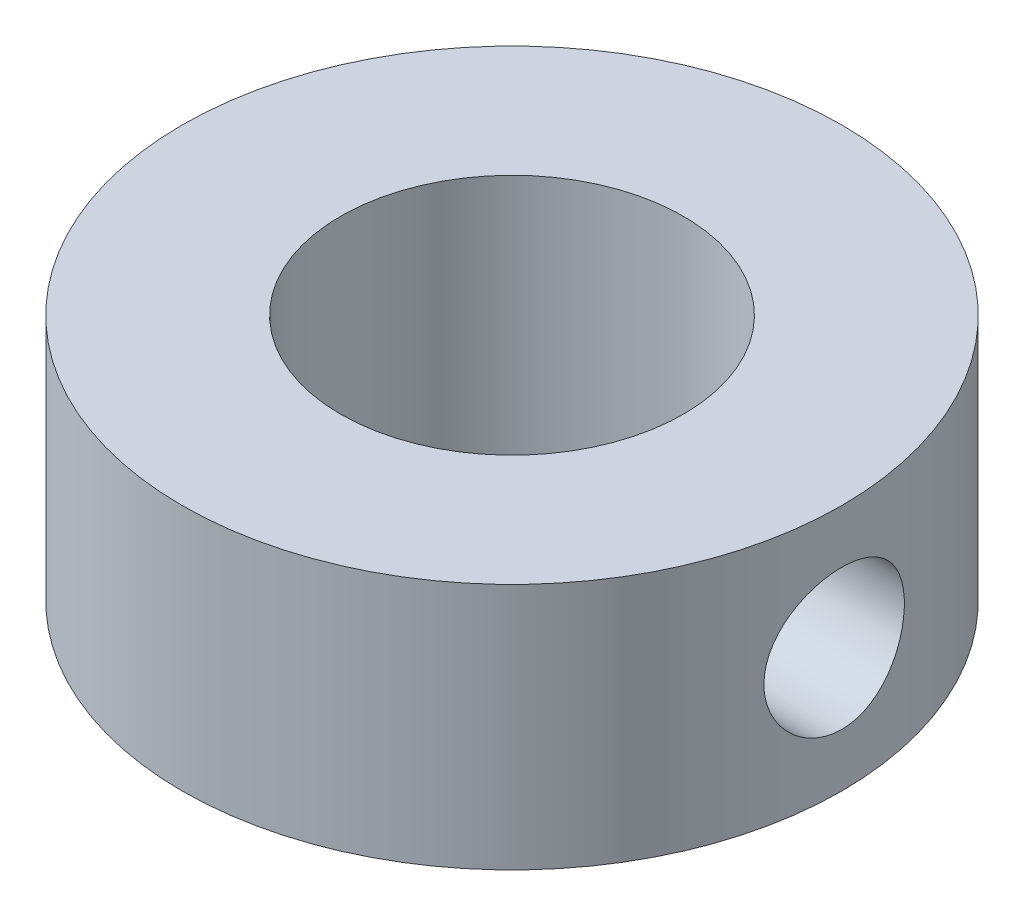
from build123d import *

# Parameters (mm, degrees)
SKETCH1_R           = 6.35
SKETCH1_R_2         = 3.302
BOSS_EXTRUDE1_DEPTH = 4.7625
SKETCH3_W           = 1.35255
SKETCH3_H           = 6.35


with BuildPart() as part:
    # Sketch1 → Boss-Extrude1 (new body)
    with BuildSketch(Plane(origin=(0, 0, 0), x_dir=(1, 0, 0), z_dir=(0, 1, 0))):
        with Locations(Location((0, 0, 0), (0, 0, 270))):
            Circle(SKETCH1_R)
        with Locations(Location((0, 0, 0), (0, 0, 270))):
            Circle(SKETCH1_R_2, mode=Mode.SUBTRACT)
    extrude(amount=BOSS_EXTRUDE1_DEPTH)

    # Sketch3 → #6-32 Tapped Hole1 (revolve, cut)
    with BuildSketch(Plane.ZX.offset(2.38125)):
        with Locations((0.676275, 3.175)):
            Rectangle(SKETCH3_W, SKETCH3_H)
    revolve(axis=Axis((-6.35, 2.38125, 0), (1, 0, 0)), mode=Mode.SUBTRACT)


solid = part.part
